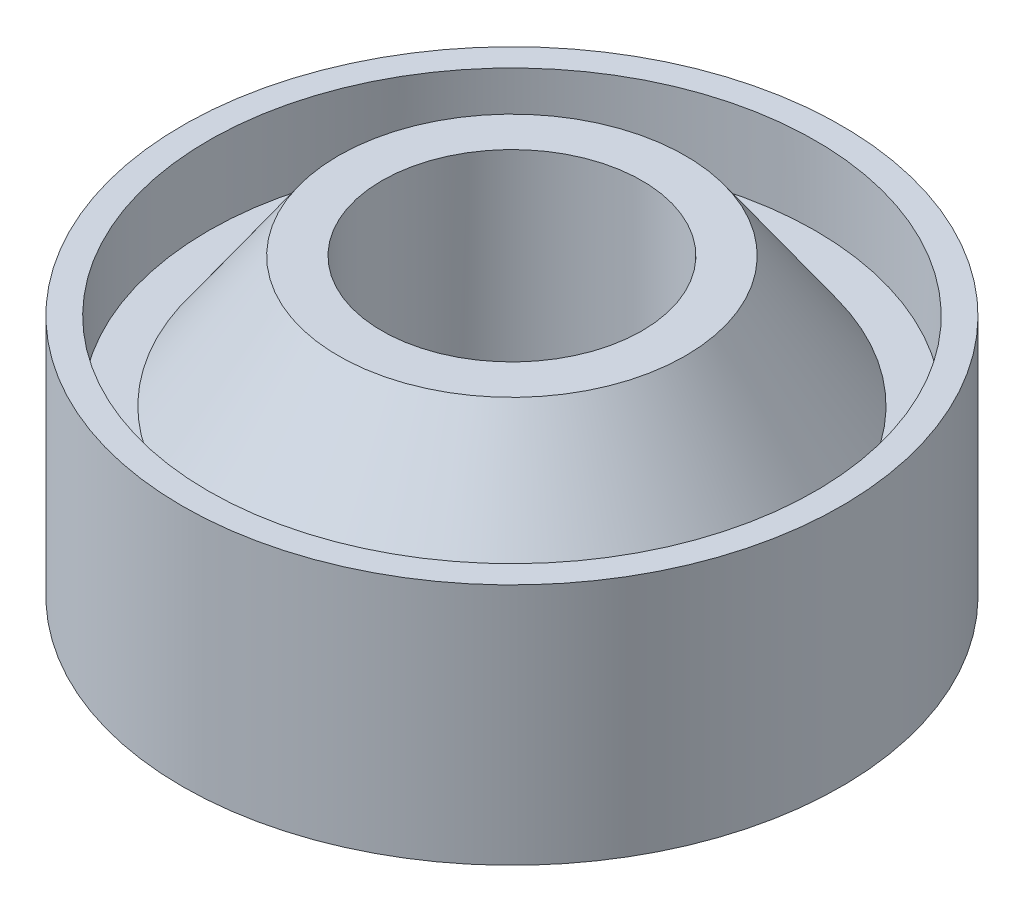
from build123d import *

# Parameters (mm, degrees)
BOSS_EXTRUDE1_DEPTH      = 14
BOSS_EXTRUDE1_DEPTH_BACK = 14
SKETCH1_R                = 38
SKETCH1_R_2              = 35
BOSS_EXTRUDE2_DEPTH      = 5
BOSS_EXTRUDE2_DEPTH_BACK = 5
SKETCH2_R                = 35
SKETCH5_R                = 20
SKETCH5_R_2              = 15
BOSS_EXTRUDE3_DEPTH      = 15
BOSS_EXTRUDE4_START      = 15
SKETCH6_R                = 20
SKETCH6_R_2              = 15
BOSS_EXTRUDE4_DEPTH      = 15
DRAFT2_ANGLE             = 35
DRAFT3_ANGLE             = 35
SKETCH14_R               = 12
CUT_EXTRUDE3_DEPTH       = 15
SKETCH15_R               = 15
CUT_EXTRUDE4_DEPTH       = 33.5


with BuildPart() as part:
    # Sketch1 → Boss-Extrude1 (new, two sides: drawn at the far end of the back side and taken through both)
    with BuildSketch(Plane(origin=(0, 0, 0), x_dir=(1, 0, 0), z_dir=(0, 1, 0)).offset(-BOSS_EXTRUDE1_DEPTH_BACK)):
        Circle(SKETCH1_R)
        Circle(SKETCH1_R_2, mode=Mode.SUBTRACT)
    extrude(amount=BOSS_EXTRUDE1_DEPTH + BOSS_EXTRUDE1_DEPTH_BACK)

    # Sketch2 → Boss-Extrude2 (add, two sides: drawn at the far end of the back side and taken through both)
    with BuildSketch(Plane(origin=(0, 0, 0), x_dir=(-1, 0, 0), z_dir=(0, -1, 0)).offset(-BOSS_EXTRUDE2_DEPTH_BACK)):
        Circle(SKETCH2_R)
    extrude(amount=BOSS_EXTRUDE2_DEPTH + BOSS_EXTRUDE2_DEPTH_BACK)

    # Sketch5 → Boss-Extrude3 (add)
    with BuildSketch(Plane(origin=(0, 5, 0), x_dir=(1, 0, 0), z_dir=(0, 1, 0))):
        Circle(SKETCH5_R)
        Circle(SKETCH5_R_2, mode=Mode.SUBTRACT)
    extrude(amount=BOSS_EXTRUDE3_DEPTH)

    # Sketch6 → Boss-Extrude4 (add)
    with BuildSketch(Plane.XZ.offset(5).offset(BOSS_EXTRUDE4_START)):
        Circle(SKETCH6_R)
        Circle(SKETCH6_R_2, mode=Mode.SUBTRACT)
    extrude(amount=-BOSS_EXTRUDE4_DEPTH)

    # Draft2
    draft2_faces = [part.faces().sort_by_distance(p)[0] for p in [
        (-20, 12.5, 0),
    ]]
    draft(draft2_faces, Plane(origin=(0, 20, 0), x_dir=(1, 0, 0), z_dir=(0, 1, 0)), DRAFT2_ANGLE)

    # Draft3
    draft3_faces = [part.faces().sort_by_distance(p)[0] for p in [
        (-20, -12.5, 0),
    ]]
    draft(draft3_faces, Plane(origin=(0, -20, 0), x_dir=(-1, 0, 0), z_dir=(0, -1, 0)), DRAFT3_ANGLE)

    # Sketch14 → Cut-Extrude3 (cut)
    with BuildSketch(Plane.XZ.offset(5)):
        Circle(SKETCH14_R)
    extrude(amount=-CUT_EXTRUDE3_DEPTH, mode=Mode.SUBTRACT)

    # Sketch15 → Cut-Extrude4 (cut, symmetric)
    with BuildSketch(Plane(origin=(0, 5, 0), x_dir=(1, 0, 0), z_dir=(0, 1, 0))):
        Circle(SKETCH15_R)
    extrude(amount=CUT_EXTRUDE4_DEPTH, both=True, mode=Mode.SUBTRACT)


solid = part.part
